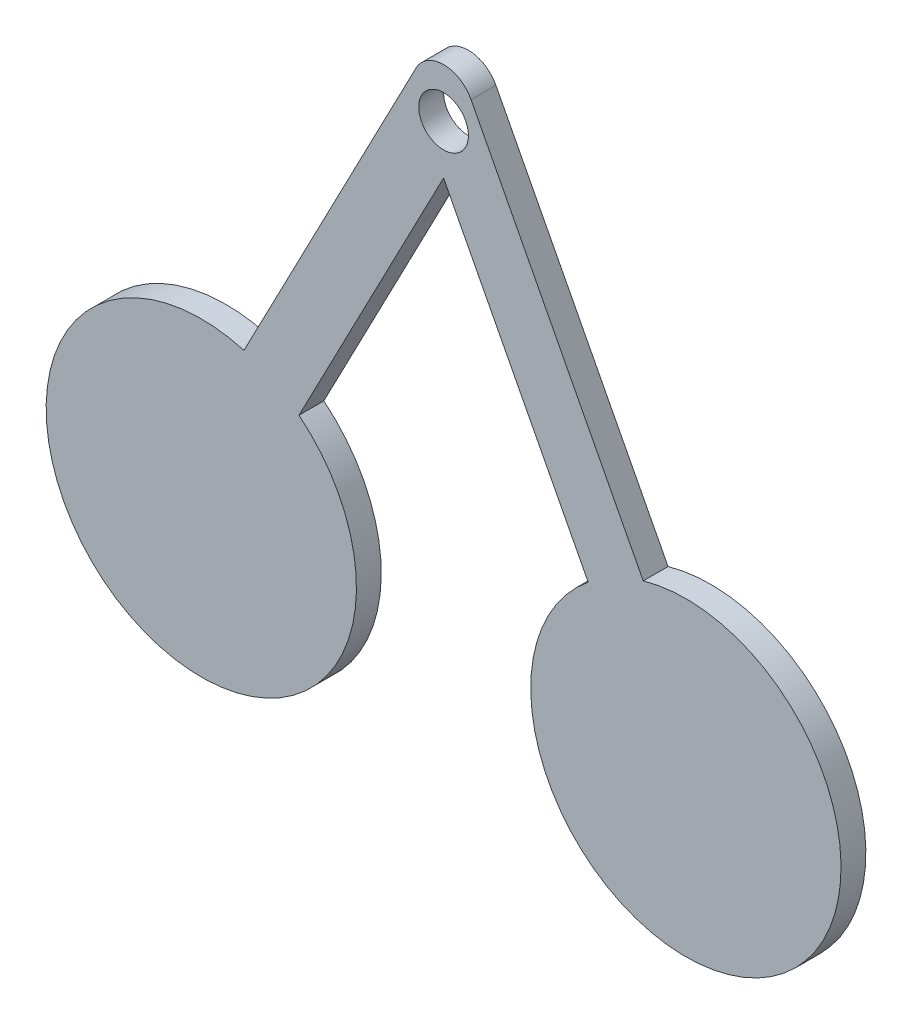
from build123d import *

# Parameters (mm, degrees)
BOSS_EXTRUDE1_DEPTH = 2
SKETCH2_R           = 2
CUT_EXTRUDE1_DEPTH  = 2


with BuildPart() as part:
    # Sketch1 → Boss-Extrude1 (new body)
    with BuildSketch(Plane.XY):
        with BuildLine():
            Line((19.521264396, 32.085798574), (31.169759249, 9.709248155))
            ThreePointArc((31.169759249, 9.709248155), (44.814386457, -11.087635415), (35.604813415, 12.017991221))
            Line((35.604813415, 12.017991221), (21.738791479, 38.654371533))
            ThreePointArc((21.738791479, 38.654371533), (19.521264396, 40), (17.303737313, 38.654371533))
            Line((17.303737313, 38.654371533), (3.437715376, 12.017991221))
            ThreePointArc((3.437715376, 12.017991221), (-5.771857665, -11.087635415), (7.872769542, 9.709248155))
            Line((7.872769542, 9.709248155), (19.521264396, 32.085798574))
        make_face()
    extrude(amount=BOSS_EXTRUDE1_DEPTH)

    # Sketch2 → Cut-Extrude1 (cut)
    with BuildSketch(Plane.XY.offset(2)):
        with Locations((19.521264396, 36.042899287)):
            Circle(SKETCH2_R)
    extrude(amount=-CUT_EXTRUDE1_DEPTH, mode=Mode.SUBTRACT)


solid = part.part
